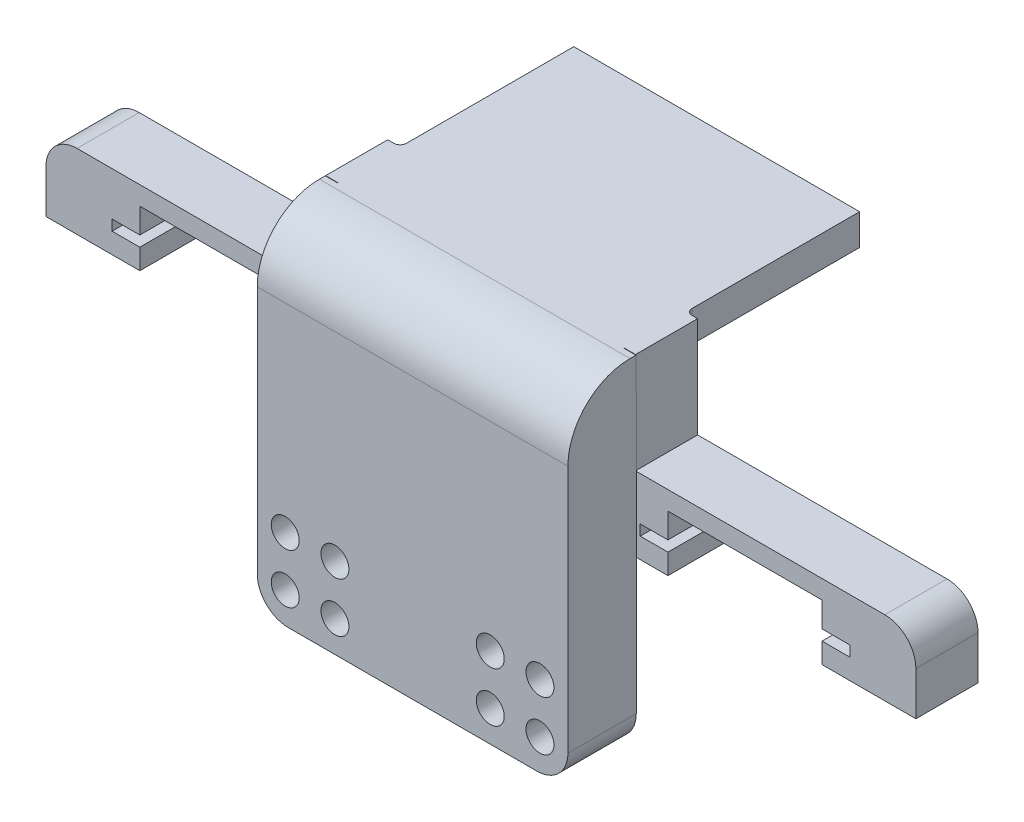
from build123d import *

# Parameters (mm, degrees)
BOSS_EXTRUDE5_DEPTH  = 5
SKETCH3_W            = 50
SKETCH3_H            = 11
BOSS_EXTRUDE6_DEPTH  = 50
SKETCH5_R            = 2.25
CUT_EXTRUDE1_DEPTH   = 11
BOSS_EXTRUDE8_DEPTH  = 10
CUT_EXTRUDE2_DEPTH   = 10
SKETCH8_W            = 2
SKETCH8_H            = 15.993233409
CUT_EXTRUDE3_DEPTH   = 5
SKETCH9_W            = 10
SKETCH9_H            = 10
BOSS_EXTRUDE9_DEPTH  = 10
SKETCH10_W           = 10
SKETCH10_H           = 10
BOSS_EXTRUDE10_DEPTH = 10
FILLET1_R            = 10
FILLET2_R            = 5
SKETCH11_W           = 15.1
SKETCH11_H           = 10
BOSS_EXTRUDE11_DEPTH = 2
SKETCH12_W           = 60.2
SKETCH12_H           = 10
BOSS_EXTRUDE12_DEPTH = 2
BOSS_EXTRUDE14_REACH = 84.491
SKETCH14_W           = 49.873600962
SKETCH14_H           = 10
FILLET3_R            = 1
SKETCH15_W           = 46
SKETCH15_H           = 5
BOSS_EXTRUDE15_DEPTH = 22


with BuildPart() as part:
    # Sketch1 → Boss-Extrude5 (new body)
    with BuildSketch(Plane(origin=(0, 0, 0), x_dir=(1, 0, 0), z_dir=(0, 1, 0))):
        Polygon((-25, 20), (25, 20), (25, 0), (25, -6.94447706), (-25, -6.94447706), (-25, 0.55552294), align=None)
    extrude(amount=BOSS_EXTRUDE5_DEPTH)

    # Sketch3 → Boss-Extrude6 (add)
    with BuildSketch(Plane.XZ):
        with Locations((0, 1.44447706)):
            Rectangle(SKETCH3_W, SKETCH3_H)
    extrude(amount=BOSS_EXTRUDE6_DEPTH)

    # Sketch5 → Cut-Extrude1 (cut)
    with BuildSketch(Plane.XY.offset(6.94447706)):
        with Locations((-20.5, -45)):
            Circle(SKETCH5_R)
        with Locations(Location((-20.5, -37, 0), (0, 0, 180))):
            Circle(SKETCH5_R)
        with Locations(Location((-12.5, -45, 0), (0, 0, 180))):
            Circle(SKETCH5_R)
        with Locations((-12.5, -37)):
            Circle(SKETCH5_R)
        with Locations((12.5, -45)):
            Circle(SKETCH5_R)
        with Locations(Location((20.5, -45, 0), (0, 0, 180))):
            Circle(SKETCH5_R)
        with Locations(Location((12.5, -37, 0), (0, 0, 180))):
            Circle(SKETCH5_R)
        with Locations((20.5, -37)):
            Circle(SKETCH5_R)
    extrude(amount=-CUT_EXTRUDE1_DEPTH, mode=Mode.SUBTRACT)

    # Sketch6 → Boss-Extrude8 (add)
    with BuildSketch(Plane(origin=(0, 0, -4.05552294), x_dir=(-1, 0, 0), z_dir=(0, 0, -1))):
        Polygon((-25, -11.208830651), (25, -11.208830651), (60, -11.208830651), (60, -21.208830651), (25, -21.208830651), (-25, -21.208830651), (-60, -21.208830651), (-60, -11.208830651), align=None)
    extrude(amount=BOSS_EXTRUDE8_DEPTH)

    # Sketch7 → Cut-Extrude2 (cut)
    with BuildSketch(Plane.XY.offset(-4.05552294)):
        Polygon((30.1, -21.208830651), (30.1, -19.929430473), (25.639200757, -19.929430473), (25.639200757, -18.229430473), (30.1, -18.229430473), (30.1, -14.208830651), (54.9, -14.208830651), (54.9, -18.229430473), (59.360799243, -18.229430473), (59.360799243, -19.929430473), (54.9, -19.929430473), (54.9, -21.208830651), align=None)
        Polygon((-25.639200757, -19.929430473), (-25.639200757, -18.229430473), (-30.1, -18.229430473), (-30.1, -14.208830651), (-54.9, -14.208830651), (-54.9, -18.229430473), (-59.360799243, -18.229430473), (-59.360799243, -19.929430473), (-54.9, -19.929430473), (-54.9, -21.208830651), (-30.1, -21.208830651), (-30.1, -19.929430473), align=None)
    extrude(amount=-CUT_EXTRUDE2_DEPTH, mode=Mode.SUBTRACT)

    # Sketch8 → Cut-Extrude3 (cut)
    with BuildSketch(Plane(origin=(0, 5, 0), x_dir=(1, 0, 0), z_dir=(0, 1, 0))):
        with Locations((-24, 12.003383296)):
            Rectangle(SKETCH8_W, SKETCH8_H)
        with Locations((24, 12.003383296)):
            Rectangle(SKETCH8_W, SKETCH8_H)
    extrude(amount=-CUT_EXTRUDE3_DEPTH, mode=Mode.SUBTRACT)

    # Sketch9 → Boss-Extrude9 (add)
    with BuildSketch(Plane.ZY.offset(60)):
        with Locations((-9.05552294, -16.208830651)):
            Rectangle(SKETCH9_W, SKETCH9_H)
    extrude(amount=BOSS_EXTRUDE9_DEPTH)

    # Sketch10 → Boss-Extrude10 (add)
    with BuildSketch(Plane(origin=(60, 0, 0), x_dir=(0, 0, -1), z_dir=(1, 0, 0))):
        with Locations((9.05552294, -16.208830651)):
            Rectangle(SKETCH10_W, SKETCH10_H)
    extrude(amount=BOSS_EXTRUDE10_DEPTH)

    # Fillet1
    fillet1_edges = [part.edges().sort_by_distance(p)[0] for p in [
        (0, 5, 6.94447706),
    ]]
    fillet(fillet1_edges, radius=FILLET1_R)

    # Fillet2
    fillet2_edges = [part.edges().sort_by_distance(p)[0] for p in [
        (-70, -11.208830651, -9.05552294),
        (70, -11.208830651, -9.05552294),
        (-25, -50, 1.44447706),
        (25, -50, 1.44447706),
    ]]
    fillet(fillet2_edges, radius=FILLET2_R)

    # Sketch11 → Boss-Extrude11 (add)
    with BuildSketch(Plane.XZ.offset(21.208830651)):
        with Locations((62.45, -9.05552294)):
            Rectangle(SKETCH11_W, SKETCH11_H)
        with Locations((-62.45, -9.05552294)):
            Rectangle(SKETCH11_W, SKETCH11_H)
    extrude(amount=BOSS_EXTRUDE11_DEPTH)

    # Sketch12 → Boss-Extrude12 (add)
    with BuildSketch(Plane.XZ.offset(21.208830651)):
        with Locations((0, -9.05552294)):
            Rectangle(SKETCH12_W, SKETCH12_H)
    extrude(amount=BOSS_EXTRUDE12_DEPTH)

    # Boss-Extrude14: up to this face of the body (flat: up to its plane)
    boss_extrude14_end = Plane(part.part.faces().sort_by_distance((0, 5, -11.488914502))[0])
    # Sketch14 → Boss-Extrude14 (add, up to the picked face)
    with BuildSketch(Plane(origin=(0, -11.208830651, 0), x_dir=(1, 0, 0), z_dir=(0, 1, 0)), mode=Mode.PRIVATE) as boss_extrude14_sk1:
        with Locations((-0.063199519, 9.05552294)):
            Rectangle(SKETCH14_W, SKETCH14_H)
    boss_extrude14_tool1 = split(extrude(boss_extrude14_sk1.sketch, amount=BOSS_EXTRUDE14_REACH, mode=Mode.PRIVATE), bisect_by=boss_extrude14_end, keep=Keep.BOTH, mode=Mode.PRIVATE)
    add(boss_extrude14_tool1.solids().sort_by(Axis((-0.0632, -11.208831, -9.055523), (0, 1, 0)))[0])

    # Fillet3
    fillet3_edges = [part.edges().sort_by_distance(p)[0] for p in [
        (-23, 2.5, -14.05552294),
        (23, 2.5, -14.05552294),
    ]]
    fillet(fillet3_edges, radius=FILLET3_R)

    # Sketch15 → Boss-Extrude15 (add)
    with BuildSketch(Plane(origin=(0, 0, -20), x_dir=(-1, 0, 0), z_dir=(0, 0, -1))):
        with Locations((0, 2.5)):
            Rectangle(SKETCH15_W, SKETCH15_H)
    extrude(amount=BOSS_EXTRUDE15_DEPTH)


solid = part.part
